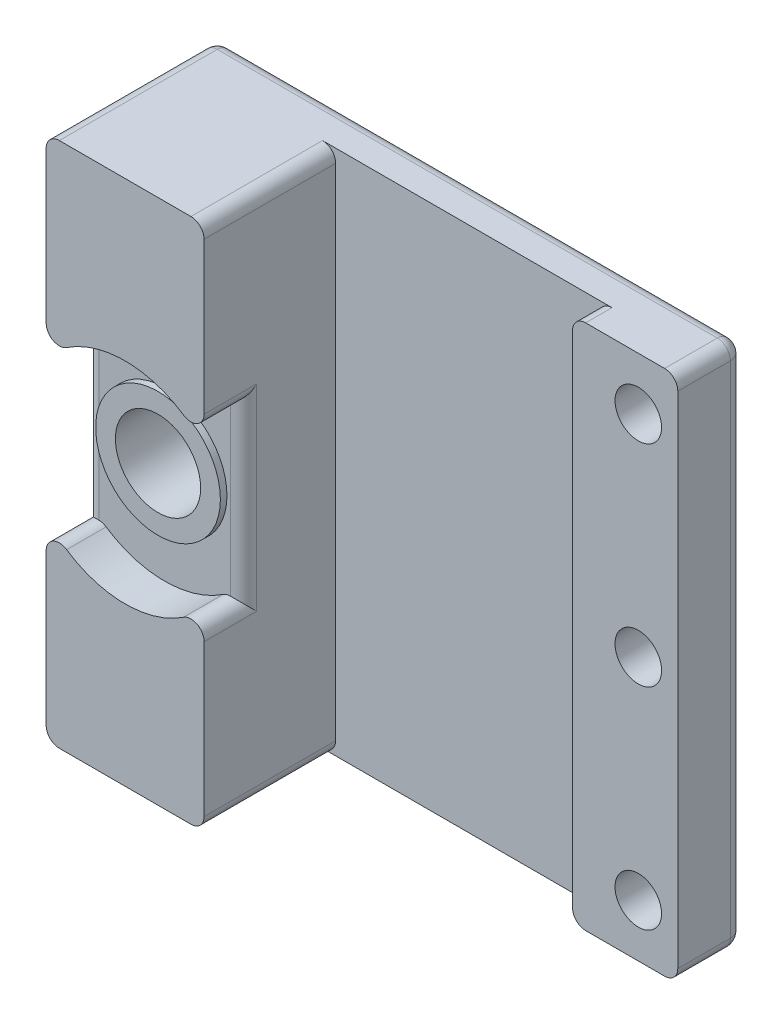
from build123d import *

# Parameters (mm, degrees)
SKETCH2_W                  = 63.5
SKETCH2_H                  = 63.5
SKETCH2_R                  = 5.1435
BOSS_EXTRUDE1_DEPTH        = 20.6375
SKETCH3_W                  = 31.75
SKETCH3_H                  = 15.875
CUT_EXTRUDE1_DEPTH         = 93.143401317
SKETCH4_W                  = 12.7
SKETCH4_H                  = 12.7
CUT_EXTRUDE2_DEPTH         = 93.143401317
SKETCH5_R                  = 12.7
CUT_EXTRUDE3_DEPTH         = 3.96875
SKETCH6_R                  = 12.7
SKETCH6_R_2                = 7.52475
CUT_EXTRUDE4_DEPTH         = 0.79375
FILLET1_R                  = 1.5875
F_10_CLEARANCE_HOLE1_D     = 5.6134
F_10_CLEARANCE_HOLE1_DEPTH = 25.4
F_10_CLEARANCE_HOLE1_TIP   = 1.686435499


with BuildPart() as part:
    # Sketch2 → Boss-Extrude1 (new body)
    with BuildSketch(Plane.XY):
        with Locations((31.75, 31.75)):
            Rectangle(SKETCH2_W, SKETCH2_H)
        with Locations((9.525, 31.75)):
            Circle(SKETCH2_R, mode=Mode.SUBTRACT)
    extrude(amount=BOSS_EXTRUDE1_DEPTH)

    # Sketch3 → Cut-Extrude1 (cut, through all)
    with BuildSketch(Plane.XZ):
        with Locations((34.925, 12.7)):
            Rectangle(SKETCH3_W, SKETCH3_H)
    extrude(amount=-CUT_EXTRUDE1_DEPTH, mode=Mode.SUBTRACT)

    # Sketch4 → Cut-Extrude2 (cut, through all)
    with BuildSketch(Plane.XZ):
        with Locations((57.15, 14.2875)):
            Rectangle(SKETCH4_W, SKETCH4_H)
    extrude(amount=-CUT_EXTRUDE2_DEPTH, mode=Mode.SUBTRACT)

    # Sketch5 → Cut-Extrude3 (cut)
    with BuildSketch(Plane.XY.offset(20.6375)):
        with Locations((9.525, 31.75)):
            Circle(SKETCH5_R)
    extrude(amount=-CUT_EXTRUDE3_DEPTH, mode=Mode.SUBTRACT)

    # Sketch6 → Cut-Extrude4 (cut)
    with BuildSketch(Plane.XY.offset(16.66875)):
        with Locations((9.525, 31.75)):
            Circle(SKETCH6_R)
        with Locations((9.525, 31.75)):
            Circle(SKETCH6_R_2, mode=Mode.SUBTRACT)
    extrude(amount=-CUT_EXTRUDE4_DEPTH, mode=Mode.SUBTRACT)

    # Fillet1
    fillet1_edges = [part.edges().sort_by_distance(p)[0] for p in [
        (19.05, 63.5, 12.7),
        (50.8, 63.5, 6.35),
        (19.05, 0, 12.7),
        (50.8, 0, 6.35),
        (63.5, 63.5, 3.96875),
        (63.5, 0, 3.96875),
        (31.75, 63.5, 0),
        (63.5, 31.75, 0),
        (19.05, 40.150260413, 18.25625),
        (19.05, 23.349739587, 18.25625),
        (31.75, 0, 0),
        (0, 40.150260413, 18.25625),
        (0, 23.349739587, 18.25625),
        (0, 31.75, 0),
        (19.05, 31.75, 15.875),
        (0, 31.75, 15.875),
        (0, 63.5, 10.31875),
        (0, 0, 10.31875),
    ]]
    fillet(fillet1_edges, radius=FILLET1_R)

    # #10 Clearance Hole1
    with Locations(Plane.XY.offset(20.6375)):
        with Locations((58.7375, 6.35), (58.7375, 31.75), (58.7375, 57.15)):
            Hole(F_10_CLEARANCE_HOLE1_D / 2, depth=F_10_CLEARANCE_HOLE1_DEPTH)
            with Locations((0, 0, -(F_10_CLEARANCE_HOLE1_DEPTH + F_10_CLEARANCE_HOLE1_TIP / 2))):  # 118° drill point
                Cone(0, F_10_CLEARANCE_HOLE1_D / 2, F_10_CLEARANCE_HOLE1_TIP, mode=Mode.SUBTRACT)


solid = part.part
